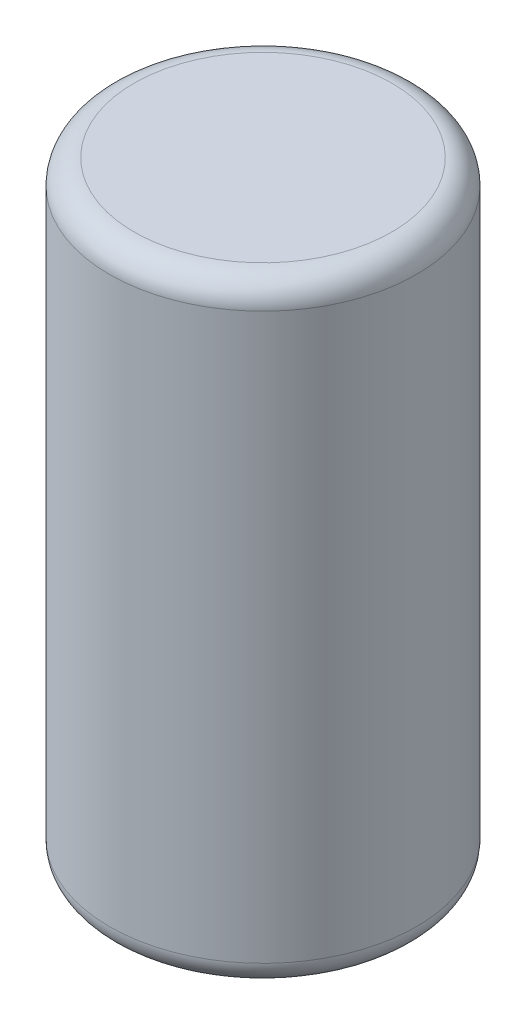
from build123d import *

# Parameters (mm, degrees)
SKETCH2_W = 1.5875
SKETCH2_H = 6.35
FILLET1_R = 0.254


with BuildPart() as part:
    # Sketch2 → Revolve1 (revolve)
    with BuildSketch(Plane(origin=(0, 0, 0), x_dir=(0, 0, -1), z_dir=(1, 0, 0)), mode=Mode.PRIVATE) as revolve1_sk:
        with Locations((0.79375, 0)):
            Rectangle(SKETCH2_W, SKETCH2_H)
    revolve(revolve1_sk.sketch.rotate(Axis((0, 4.250740132, 0), (0, -1, 0)), 180), axis=Axis((0, 4.250740132, 0), (0, -1, 0)))

    # Fillet1
    fillet1_edges = [part.edges().sort_by_distance(p)[0] for p in [
        (0, 3.175, -1.5875),
        (0, -3.175, -1.5875),
    ]]
    fillet(fillet1_edges, radius=FILLET1_R)


solid = part.part
